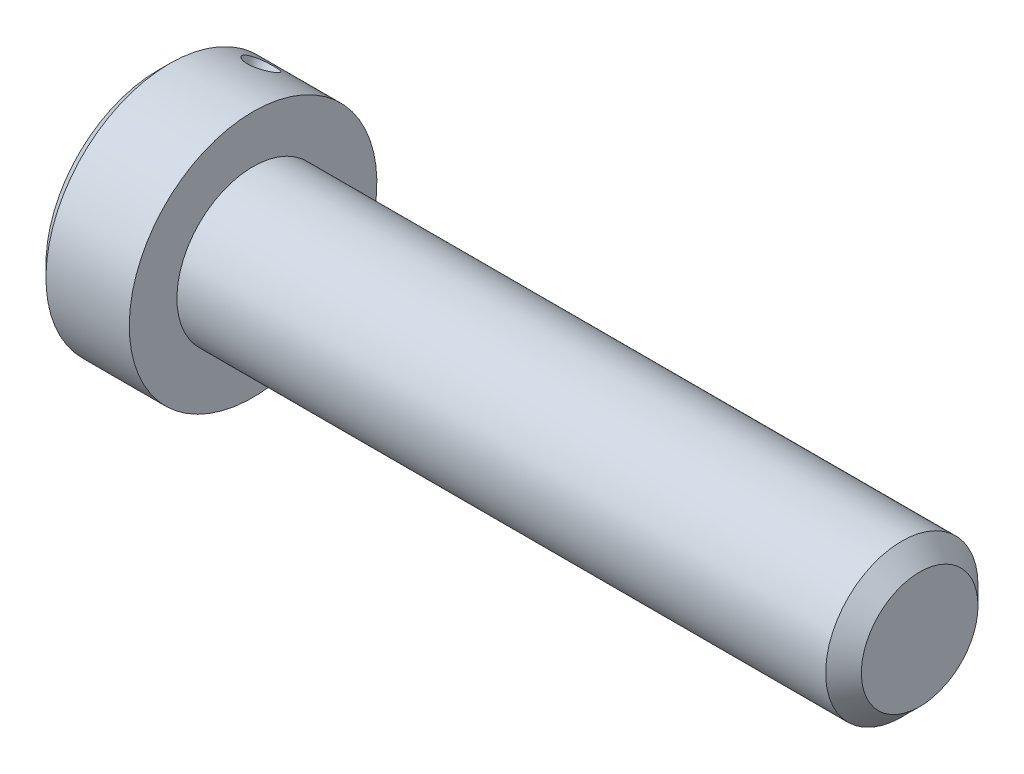
from build123d import *

# Parameters (mm, degrees)
SKETCH2_R               = 4
BOSS_EXTRUDE1_DEPTH     = 22
CHAMFER1_SIZE           = 0.9375
CUT_EXTRUDE1_DEPTH      = 3.95
CUT_EXTRUDE3_DEPTH      = 26.325793682
CUT_EXTRUDE3_DEPTH_BACK = 26.325793682
SKETCH11_R              = 0.79375


with BuildPart() as part:
    # Sketch2 → Boss-Extrude1 (new body)
    with BuildSketch(Plane(origin=(17.5, 0, 0), x_dir=(0, 0, -1), z_dir=(1, 0, 0))):
        Circle(SKETCH2_R)
    extrude(amount=-BOSS_EXTRUDE1_DEPTH)

    # Chamfer1
    chamfer1_edges = [part.edges().sort_by_distance(p)[0] for p in [
        (17.5, 0, 4),
    ]]
    chamfer(chamfer1_edges, length=CHAMFER1_SIZE)

    # Sketch10 → Revolve2 (revolve)
    with BuildSketch(Plane.XY, mode=Mode.PRIVATE) as revolve2_sk:
        Polygon((-2.190598923, 0), (-4.5, 4), (-17.5, 4), (-17.5, 0), align=None)
    revolve(revolve2_sk.sketch.rotate(Axis((-17.5, 0, 0), (1, 0, 0)), 270), axis=Axis((-17.5, 0, 0), (1, 0, 0)))

    # Sketch6 → Revolve1 (revolve)
    with BuildSketch(Plane.XY):
        Polygon((-21.875, 6.5), (-22.5, 5.875), (-22.5, 0), (-17.5, 0), (-17.5, 6.5), align=None)
    revolve(axis=Axis((-17.5, 0, 0), (-1, 0, 0)))

    # Sketch4 → Cut-Extrude1 (cut)
    with BuildSketch(Plane(origin=(-22.5, 0, 0), x_dir=(0, 0, -1), z_dir=(1, 0, 0))):
        Polygon((0, 2.886751346), (-2.5, 1.443375673), (-2.5, -1.443375673), (0, -2.886751346), (2.5, -1.443375673), (2.5, 1.443375673), align=None)
    extrude(amount=CUT_EXTRUDE1_DEPTH, mode=Mode.SUBTRACT)

    # Cut-Extrude2 cone 1 section (through the dimple's axis) → Cut-Extrude2 (revolve, cut)
    with BuildSketch(Plane(origin=(-22.5, 0, 0), x_dir=(0, 0, 1), z_dir=(0, 1, 0))):
        Polygon((0, 0), (2.886751346, 0), (0, 2.886751346), align=None)
    revolve(axis=Axis((-22.5, 0, 0), (1, 0, 0)), mode=Mode.SUBTRACT)

    # Sketch11 → Cut-Extrude3 (cut, two sides: drawn at the far end of the back side and taken through both)
    with BuildSketch(Plane(origin=(0, 2.165063509, -1.25), x_dir=(1, 0, 0), z_dir=(0, -0.8660254037844387, 0.49999999999999994)).offset(-CUT_EXTRUDE3_DEPTH_BACK)):
        with Locations(Location((-20.331624369, 0, 0), (0, 0, 270))):
            Circle(SKETCH11_R)
    extrude(amount=CUT_EXTRUDE3_DEPTH + CUT_EXTRUDE3_DEPTH_BACK, mode=Mode.SUBTRACT)


solid = part.part
